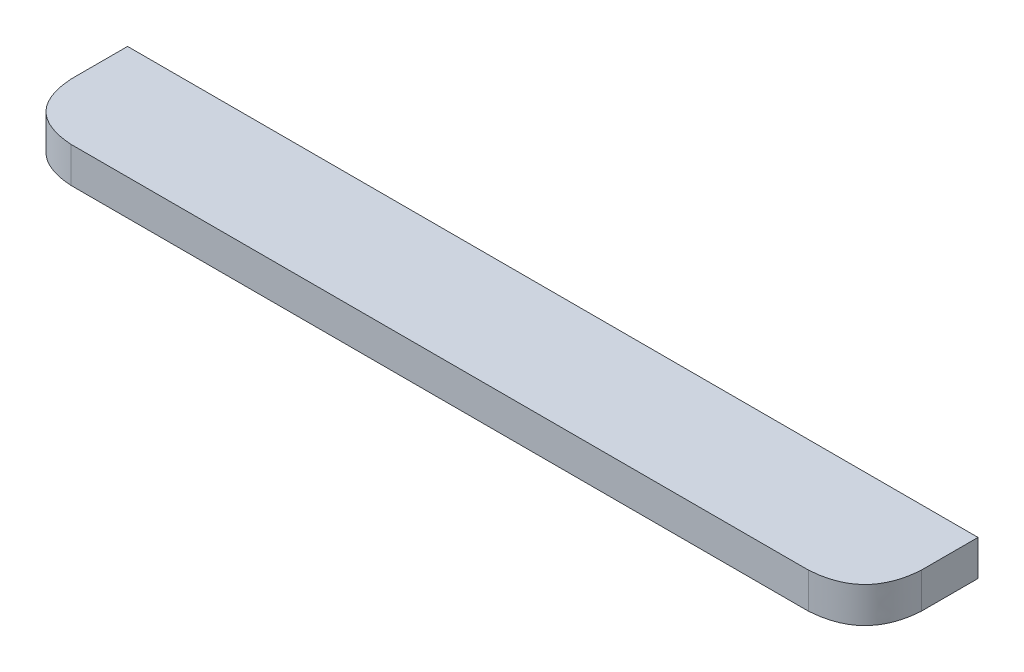
from build123d import *

# Parameters (mm, degrees)
BOSS_EXTRUDE1_DEPTH = 8


with BuildPart() as part:
    # Sketch1 → Boss-Extrude1 (new body)
    with BuildSketch(Plane(origin=(0, 0, 0), x_dir=(1, 0, 0), z_dir=(0, 1, 0))):
        with BuildLine():
            Line((-82.804, -12.7), (82.804, -12.7))
            add(Edge.make_bspline(
                [(82.804, -12.7), (94.773722487, -11.969722487), (95.504, 0)],
                knots=[0, 0, 0, 1, 1, 1], degree=2))
            Line((95.504, 0), (95.504, 12.7))
            Line((95.504, 12.7), (-95.504, 12.7))
            Line((-95.504, 12.7), (-95.504, 0))
            add(Edge.make_bspline(
                [(-82.804, -12.7), (-94.773722487, -11.969722487), (-95.504, 0)],
                knots=[0, 0, 0, 1, 1, 1], degree=2))
        make_face()
    extrude(amount=BOSS_EXTRUDE1_DEPTH)


solid = part.part
